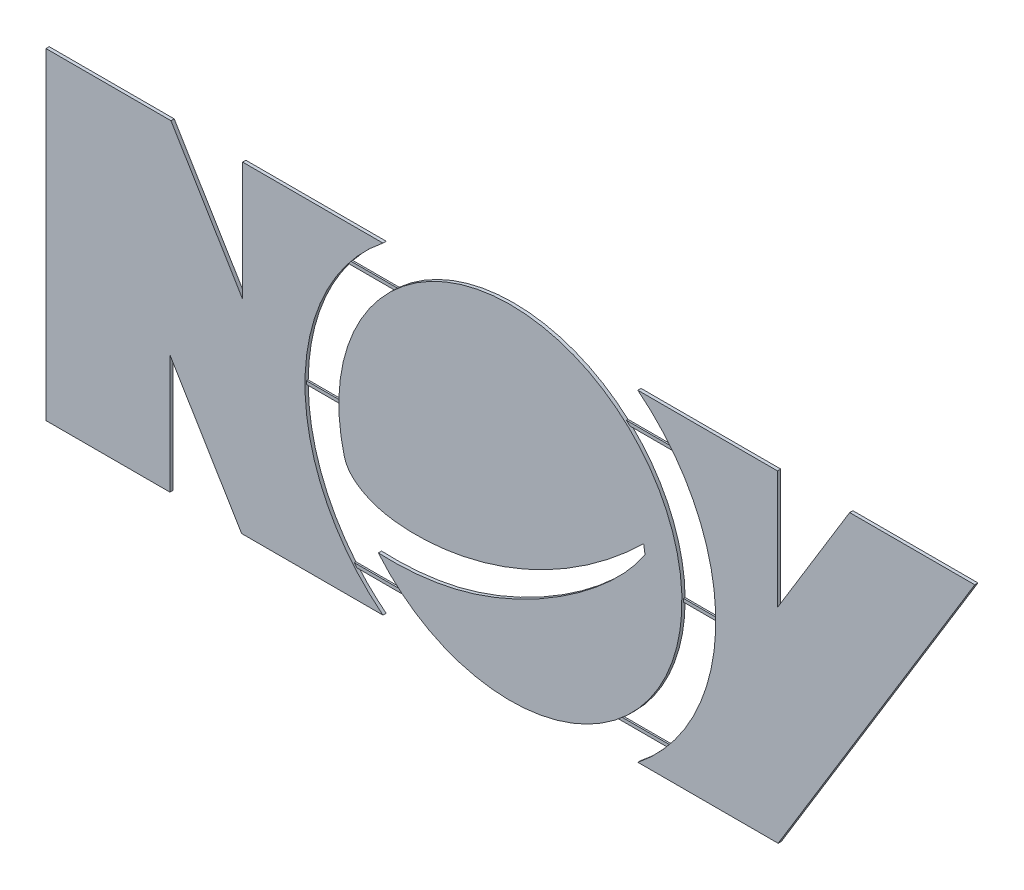
from build123d import *

# Parameters (mm, degrees)
BOSS_EXTRUDE1_DEPTH   = 0.6
BOSS_EXTRUDE1_2_DEPTH = 0.6
BOSS_EXTRUDE1_3_DEPTH = 0.6
BOSS_EXTRUDE2_DEPTH   = 0.3


with BuildPart() as part:
    # Sketch1 → Boss-Extrude1 (new body)
    with BuildSketch(Plane.XY):
        with BuildLine():
            ThreePointArc((62.865529661, 62.061281034), (48.313215527, 32.007787602), (62.856663932, 1.950002877))
            Line((62.856663932, 1.950002877), (36.497449361, 1.950002877))
            Line((36.497449361, 1.950002877), (23.111234398, 24.145438461))
            Line((23.111234398, 24.145438461), (23.111234398, 1.950002877))
            Line((23.111234398, 1.950002877), (0, 1.950002877))
            Line((0, 1.950002877), (0, 62.061281034))
            Line((0, 62.061281034), (23.3158368, 62.061281034))
            Line((23.3158368, 62.061281034), (36.689087616, 39.887341061))
            Line((36.689087616, 39.887341061), (36.689087616, 62.061281034))
            Line((36.689087616, 62.061281034), (62.865529661, 62.061281034))
        make_face()
    extrude(amount=BOSS_EXTRUDE1_DEPTH)



with BuildPart() as body_2:
    # Sketch1 → Boss-Extrude1 2 (new body)
    with BuildSketch(Plane.XY):
        with BuildLine():
            add(Edge.make_bspline(
                [(55.665817619, 23.934470135), (56.300995164, 21.632545966), (60.312610701, 18.883485306), (68.000137108, 17.687938813), (77.626036713, 18.475223123), (88.050691987, 21.709552098), (99.970855751, 27.901244554), (107.303663525, 33.692026699), (111.490621497, 37.816257369)],
                knots=[0.00273107, 0.00273107, 0.00273107, 0.00273107, 0.111443696, 0.211566761, 0.368518187, 0.562067367, 0.722926062, 1, 1, 1, 1], degree=3))
            Line((111.490621497, 37.816257369), (111.75160581, 36.138246697))
            add(Edge.make_bspline(
                [(61.999805678, 11.574793615), (65.651806063, 11.384741592), (84.022958412, 12.171806498), (105.244079008, 26.24652902), (111.75160581, 36.138246697)],
                knots=[0, 0, 0, 0, 0.285157646, 1, 1, 1, 1], degree=3))
            ThreePointArc((61.999805678, 11.574793615), (115.155551398, 46.516849232), (55.620719661, 24.109610138))
            ThreePointArc((55.620719661, 24.109610138), (55.643144919, 24.022008279), (55.665817619, 23.934470135))
        make_face()
    extrude(amount=BOSS_EXTRUDE1_2_DEPTH)


with BuildPart() as body_3:
    # Sketch1 → Boss-Extrude1 3 (new body)
    with BuildSketch(Plane.XY):
        with BuildLine():
            ThreePointArc((110.412012767, 1.950002877), (124.955461171, 32.007787602), (110.403147038, 62.061281034))
            Line((110.403147038, 62.061281034), (136.46819788, 62.061281034))
            Line((136.46819788, 62.061281034), (136.46819788, 40.00376678))
            Line((136.46819788, 40.00376678), (149.928389856, 62.061281034))
            Line((149.928389856, 62.061281034), (173.268679959, 62.061281034))
            Line((173.268679959, 62.061281034), (136.586879163, 1.950002877))
            Line((136.586879163, 1.950002877), (110.412012767, 1.950002877))
        make_face()
    extrude(amount=BOSS_EXTRUDE1_3_DEPTH)


with BuildPart() as part_1:
    add(part.part)

    add(body_2.part)  # Boss-Extrude2 merges body 2

    add(body_3.part)  # Boss-Extrude2 merges body 3
    # Sketch2 → Boss-Extrude2 (add)
    with BuildSketch(Plane.XY):
        with BuildLine():
            Line((65.288187558, 55.844919694), (56.63383608, 55.844919694))
            ThreePointArc((56.63383608, 55.844919694), (56.398742844, 55.546078646), (56.166626305, 55.244919694))
            Line((56.166626305, 55.244919694), (64.63639539, 55.244919694))
            ThreePointArc((64.63639539, 55.244919694), (64.960215166, 55.547175229), (65.288187558, 55.844919694))
        make_face()
        with BuildLine():
            Line((66.093618581, 7.462059575), (57.201479987, 7.462059575))
            ThreePointArc((57.201479987, 7.462059575), (57.455341197, 7.160746592), (57.7122869, 6.862059575))
            Line((57.7122869, 6.862059575), (66.83249305, 6.862059575))
            ThreePointArc((66.83249305, 6.862059575), (66.460825045, 7.159312475), (66.093618581, 7.462059575))
        make_face()
        with BuildLine():
            Line((54.634511424, 32.386297359), (48.315140731, 32.386297359))
            ThreePointArc((48.315140731, 32.386297359), (48.313307535, 32.086299938), (48.313822955, 31.786297359))
            Line((48.313822955, 31.786297359), (54.632933422, 31.786297359))
            ThreePointArc((54.632933422, 31.786297359), (54.632316231, 32.086301058), (54.634511424, 32.386297359))
        make_face()
        with BuildLine():
            Line((116.067196712, 7.462059575), (107.175058117, 7.462059575))
            ThreePointArc((107.175058117, 7.462059575), (106.807851654, 7.159312475), (106.436183649, 6.862059575))
            Line((106.436183649, 6.862059575), (115.556389799, 6.862059575))
            ThreePointArc((115.556389799, 6.862059575), (115.813335501, 7.160746592), (116.067196712, 7.462059575))
        make_face()
        with BuildLine():
            Line((124.953535967, 32.386297359), (118.634165275, 32.386297359))
            ThreePointArc((118.634165275, 32.386297359), (118.636360468, 32.086301058), (118.635743276, 31.786297359))
            Line((118.635743276, 31.786297359), (124.954853744, 31.786297359))
            ThreePointArc((124.954853744, 31.786297359), (124.955369164, 32.086299938), (124.953535967, 32.386297359))
        make_face()
        with BuildLine():
            Line((116.634840619, 55.844919694), (107.980489141, 55.844919694))
            ThreePointArc((107.980489141, 55.844919694), (108.308461533, 55.547175229), (108.632281309, 55.244919694))
            Line((108.632281309, 55.244919694), (117.102050394, 55.244919694))
            ThreePointArc((117.102050394, 55.244919694), (116.869933855, 55.546078646), (116.634840619, 55.844919694))
        make_face()
    extrude(amount=BOSS_EXTRUDE2_DEPTH)


solid = part_1.part
